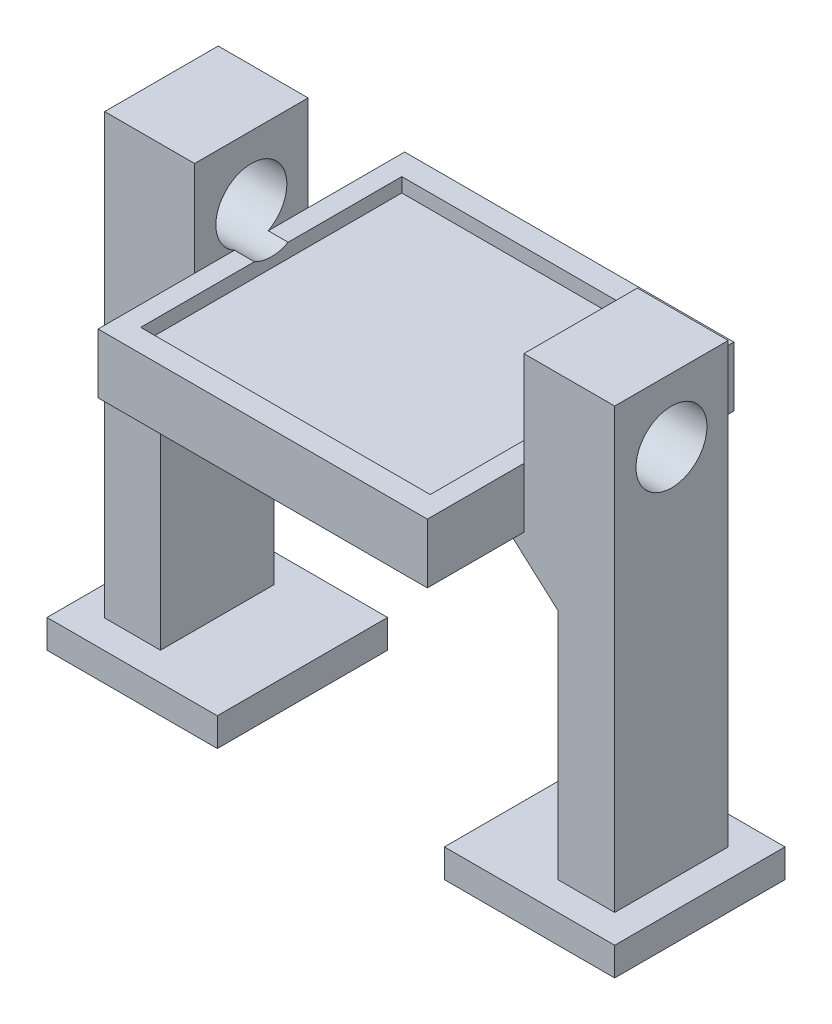
from build123d import *

# Parameters (mm, degrees)
SKETCH1_W            = 14.732
SKETCH1_H            = 13.716
BOSS_EXTRUDE1_DEPTH  = 2.032
SKETCH6_W            = 25.4
SKETCH6_H            = 5.08
BOSS_EXTRUDE2_DEPTH  = 12.7
SKETCH16_W           = 7.62
SKETCH16_H           = 7.62
BOSS_EXTRUDE5_DEPTH  = 1.27
SKETCH15_W           = 1.27
SKETCH15_H           = 12.7
SKETCH15_W_2         = 1.31
CUT_EXTRUDE5_DEPTH   = 10
SKETCH17_W           = 4.024
SKETCH17_H           = 5.08
BOSS_EXTRUDE10_DEPTH = 6.9215
SKETCH21_W           = 4.064
SKETCH21_H           = 5.08
BOSS_EXTRUDE11_DEPTH = 6.9215
SKETCH24_W           = 14.732
SKETCH24_H           = 13.716
SKETCH24_W_2         = 12.954
SKETCH24_H_2         = 11.684
BOSS_EXTRUDE12_DEPTH = 0.635
SKETCH23_R           = 1.5875
CUT_EXTRUDE6_DEPTH   = 25.7175


with BuildPart() as part:
    # Sketch1 → Boss-Extrude1 (new body)
    with BuildSketch(Plane(origin=(0, 0, 0), x_dir=(1, 0, 0), z_dir=(0, 1, 0))):
        Rectangle(SKETCH1_W, SKETCH1_H)
    extrude(amount=BOSS_EXTRUDE1_DEPTH)

    # Sketch6 → Boss-Extrude2 (add)
    with BuildSketch(Plane(origin=(0, 0, 0), x_dir=(-1, 0, 0), z_dir=(0, -1, 0))):
        Rectangle(SKETCH6_W, SKETCH6_H)
    extrude(amount=BOSS_EXTRUDE2_DEPTH)

    # Sketch16 → Boss-Extrude5 (add)
    with BuildSketch(Plane.XZ.offset(12.7)):
        with Locations((8.89, 0)):
            Rectangle(SKETCH16_W, SKETCH16_H)
        with Locations((-8.89, 0)):
            Rectangle(SKETCH16_W, SKETCH16_H)
    extrude(amount=BOSS_EXTRUDE5_DEPTH)

    # Sketch15 → Cut-Extrude5 (cut)
    with BuildSketch(Plane(origin=(0, 0, -2.54), x_dir=(-1, 0, 0), z_dir=(0, 0, -1))):
        with Locations((-12.065, -6.35)):
            Rectangle(SKETCH15_W, SKETCH15_H)
        Polygon((-8.89, -2.27), (-8.89, -12.7), (8.89, -12.7), (8.89, -2.27), (6.166, 0), (-6.35, 0), align=None)
        with Locations((12.045, -6.35)):
            Rectangle(SKETCH15_W_2, SKETCH15_H)
    extrude(amount=-CUT_EXTRUDE5_DEPTH, mode=Mode.SUBTRACT)

    # Sketch17 → Boss-Extrude10 (add)
    with BuildSketch(Plane(origin=(0, 0, 0), x_dir=(1, 0, 0), z_dir=(0, 1, 0))):
        with Locations((-9.378, 0)):
            Rectangle(SKETCH17_W, SKETCH17_H)
    extrude(amount=BOSS_EXTRUDE10_DEPTH)

    # Sketch21 → Boss-Extrude11 (add)
    with BuildSketch(Plane(origin=(0, 0, 0), x_dir=(1, 0, 0), z_dir=(0, 1, 0))):
        with Locations((9.398, 0)):
            Rectangle(SKETCH21_W, SKETCH21_H)
    extrude(amount=BOSS_EXTRUDE11_DEPTH)

    # Sketch24 → Boss-Extrude12 (add)
    with BuildSketch(Plane(origin=(0, 2.032, 0), x_dir=(1, 0, 0), z_dir=(0, 1, 0))):
        Rectangle(SKETCH24_W, SKETCH24_H)
        Rectangle(SKETCH24_W_2, SKETCH24_H_2, mode=Mode.SUBTRACT)
    extrude(amount=BOSS_EXTRUDE12_DEPTH)

    # Sketch23 → Cut-Extrude6 (cut)
    with BuildSketch(Plane.ZY.offset(11.39)):
        with Locations((0, 4.064)):
            Circle(SKETCH23_R)
    extrude(amount=-CUT_EXTRUDE6_DEPTH, mode=Mode.SUBTRACT)


solid = part.part
